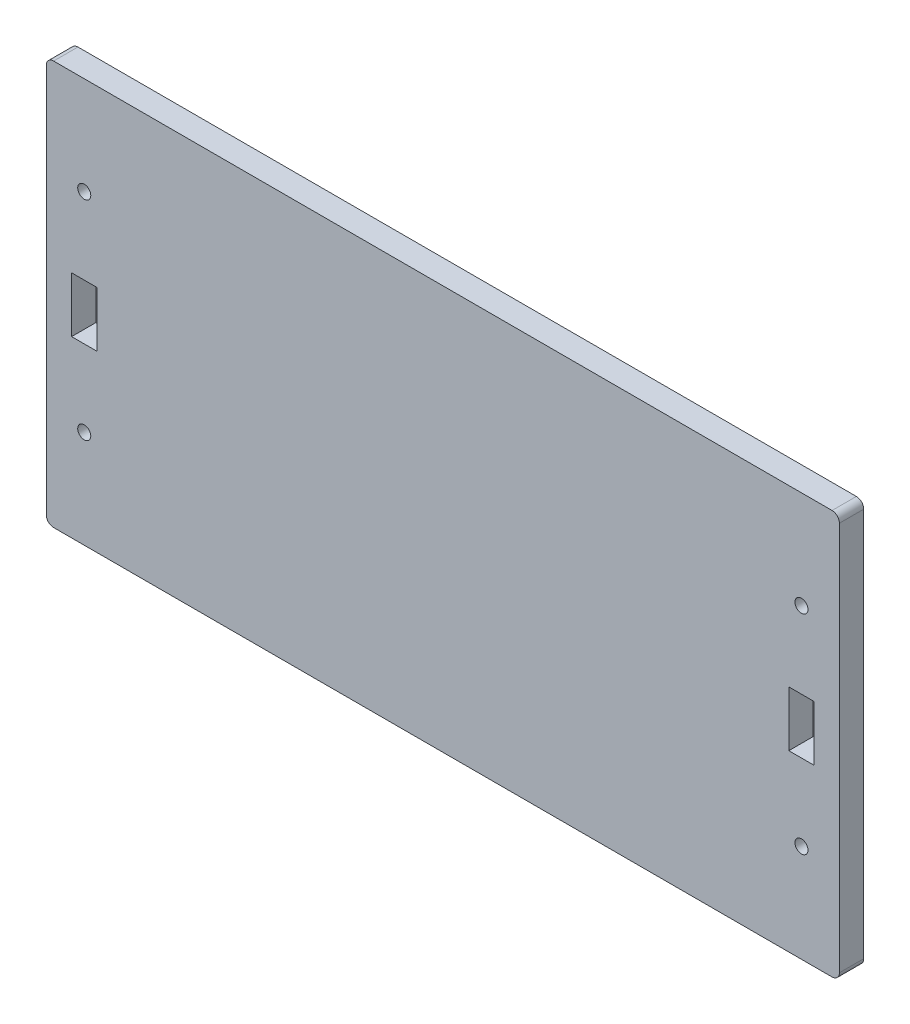
from build123d import *

# Parameters (mm, degrees)
MODEL_R             = 1.775
MODEL_W             = 6.859999999
MODEL_H             = 15
MODEL_W_2           = 6.860000001
BOSS_EXTRUDE1_DEPTH = 6.6


with BuildPart() as part:
    # Model → Boss-Extrude1 (new body)
    with BuildSketch(Plane.XY):
        with BuildLine():
            Line((213.279999903, 109.659999999), (2.000000001, 109.659999999))
            ThreePointArc((2.000000001, 109.659999999), (0.585786439, 109.074213562), (0, 107.660000001))
            Line((0, 107.660000001), (0, 2.000000001))
            ThreePointArc((0, 2.000000001), (0.585786438, 0.585786438), (2.000000001, 0))
            Line((2.000000001, 0), (213.279999903, 0))
            ThreePointArc((213.279999903, 0), (214.694213466, 0.585786438), (215.279999904, 2.000000001))
            Line((215.279999904, 2.000000001), (215.279999904, 107.660000001))
            ThreePointArc((215.279999904, 107.660000001), (214.694213465, 109.074213562), (213.279999903, 109.659999999))
        make_face()
        with Locations((10.31, 83.101155497)):
            Circle(MODEL_R, mode=Mode.SUBTRACT)
        with Locations((10.31, 26.551155498)):
            Circle(MODEL_R, mode=Mode.SUBTRACT)
        with Locations((204.970000001, 26.551155498)):
            Circle(MODEL_R, mode=Mode.SUBTRACT)
        with Locations((204.970000001, 83.101155497)):
            Circle(MODEL_R, mode=Mode.SUBTRACT)
        with Locations((204.97, 54.826155497)):
            Rectangle(MODEL_W, MODEL_H, mode=Mode.SUBTRACT)
        with Locations((10.31, 54.826155497)):
            Rectangle(MODEL_W_2, MODEL_H, mode=Mode.SUBTRACT)
    extrude(amount=BOSS_EXTRUDE1_DEPTH)


solid = part.part
